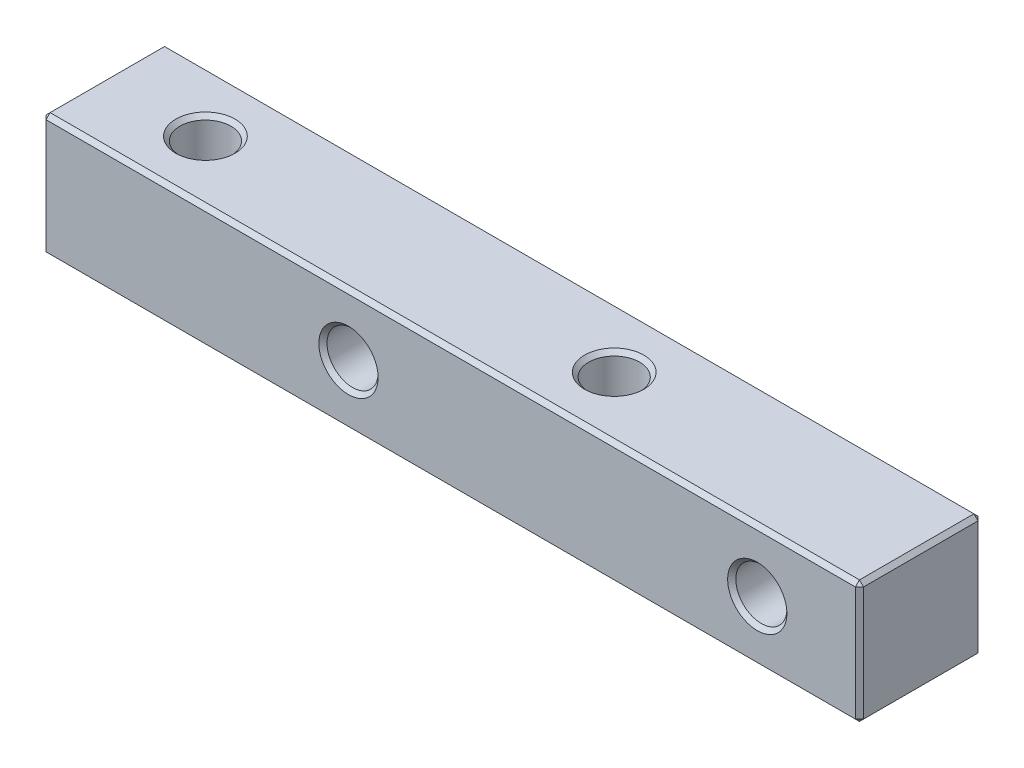
from build123d import *

# Parameters (mm, degrees)
SKETCH_1_W         = 40
SKETCH_1_H         = 6
EXTRUDE_1_DEPTH    = 3
HOLE_WIZARD_M3_1_D = 2.5
HOLE_WIZARD_M3_2_D = 2.5
CHAMFER_1_SIZE     = 0.2


with BuildPart() as part:
    # 草图1 → 凸台-拉伸1 (new, symmetric)
    with BuildSketch(Plane(origin=(0, 0, 0), x_dir=(1, 0, 0), z_dir=(0, 1, 0))):
        Rectangle(SKETCH_1_W, SKETCH_1_H)
    extrude(amount=EXTRUDE_1_DEPTH, both=True)

    # M3 螺纹孔1 (through all)
    with Locations(Plane(origin=(0, 3, 0), x_dir=(1, 0, 0), z_dir=(0, 1, 0))):
        with Locations((-15, 0), (5, 0)):
            Hole(HOLE_WIZARD_M3_1_D / 2)

    # M3 螺纹孔2 (through all)
    with Locations(Plane(origin=(0, 0, -3), x_dir=(-1, 0, 0), z_dir=(0, 0, -1))):
        with Locations((-15, 0), (5, 0)):
            Hole(HOLE_WIZARD_M3_2_D / 2)

    # 倒角1
    chamfer_1_edges = [part.edges().sort_by_distance(p)[0] for p in [
        (-20, 3, 0),
        (6.25, 3, 0),
        (6.25, -3, 0),
        (0, 3, 3),
        (-13.75, 3, 0),
        (-13.75, -3, 0),
        (-6.25, 0, -3),
        (-6.25, 0, 3),
        (13.75, 0, -3),
        (13.75, 0, 3),
        (20, 3, 0),
        (0, -3, 3),
        (-20, -3, 0),
        (0, -3, -3),
        (20, -3, 0),
        (20, 0, 3),
        (-20, 0, 3),
        (-20, 0, -3),
        (20, 0, -3),
        (0, 3, -3),
    ]]
    chamfer(chamfer_1_edges, length=CHAMFER_1_SIZE)


solid = part.part
